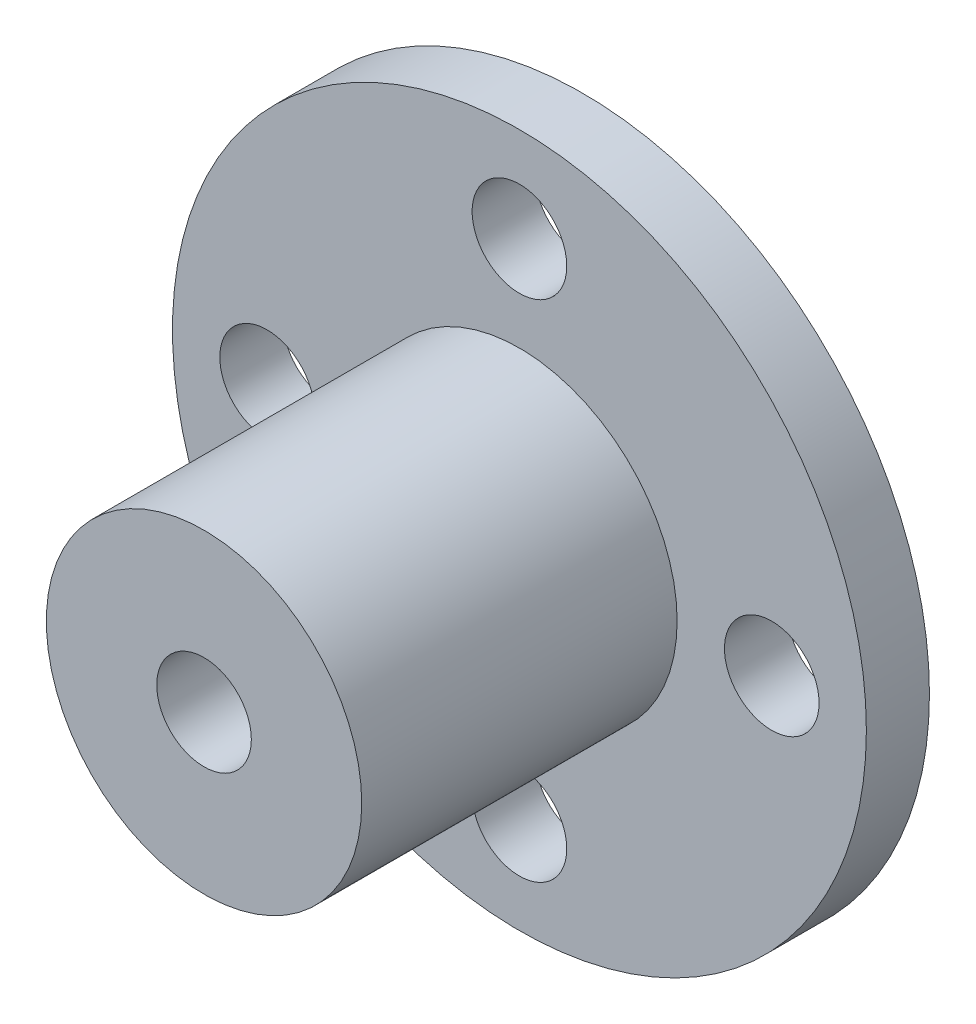
from build123d import *

# Parameters (mm, degrees)
SKETCH_1_R          = 11
SKETCH_1_R_2        = 1.5
EXTRUDE_1_DEPTH     = 2
SKETCH_4_R          = 5
EXTRUDE_3_DEPTH     = 10
SKETCH_5_R          = 1.5
CUT_EXTRUDE_2_DEPTH = 20.646882704


with BuildPart() as part:
    # 草图1 → 凸台-拉伸1 (new body)
    with BuildSketch(Plane.XY):
        Circle(SKETCH_1_R)
        with Locations((0, 8)):
            Circle(SKETCH_1_R_2, mode=Mode.SUBTRACT)
        with Locations((8, 0)):
            Circle(SKETCH_1_R_2, mode=Mode.SUBTRACT)
        with Locations((0, -8)):
            Circle(SKETCH_1_R_2, mode=Mode.SUBTRACT)
        with Locations((-8, 0)):
            Circle(SKETCH_1_R_2, mode=Mode.SUBTRACT)
    extrude(amount=EXTRUDE_1_DEPTH)

    # 草图4 → 凸台-拉伸3 (add)
    with BuildSketch(Plane.XY.offset(2)):
        Circle(SKETCH_4_R)
    extrude(amount=EXTRUDE_3_DEPTH)

    # 草图5 → 切除-拉伸2 (cut, through all)
    with BuildSketch(Plane.XY.offset(12)):
        Circle(SKETCH_5_R)
    extrude(amount=-CUT_EXTRUDE_2_DEPTH, mode=Mode.SUBTRACT)


solid = part.part
